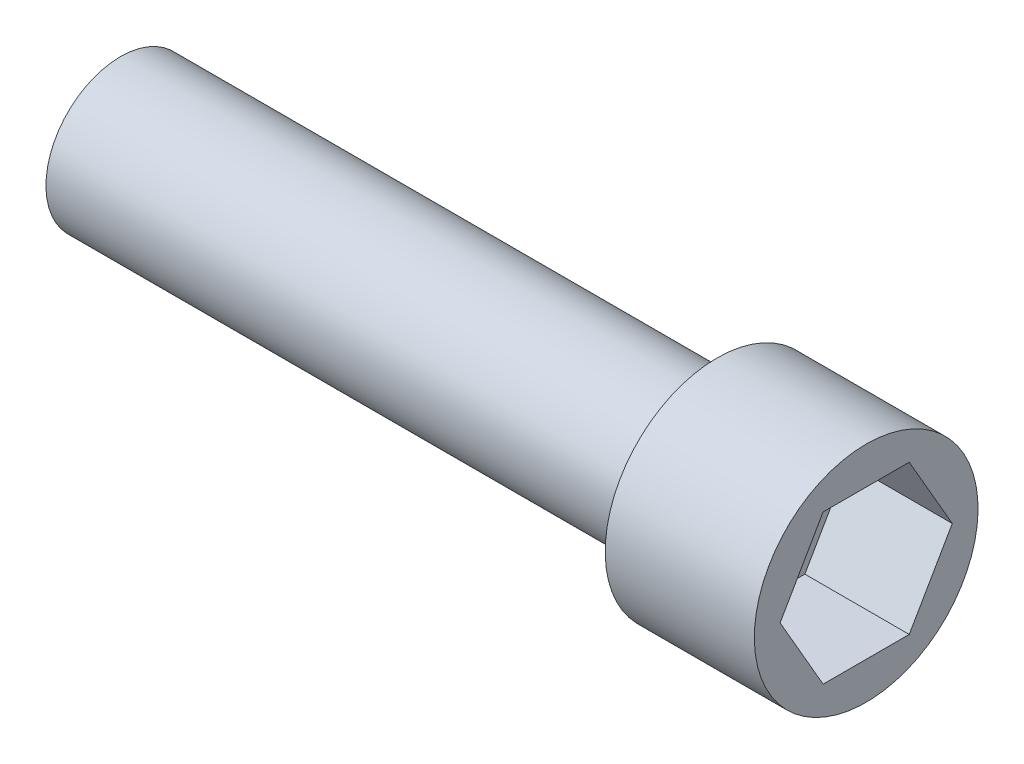
from build123d import *

# Parameters (mm, degrees)
CUT_EXTRUDE2_DEPTH = 7


with BuildPart() as part:
    # Sketch1 → Revolve1 (revolve)
    with BuildSketch(Plane.XY):
        Polygon((0, 0), (0, 5), (40, 5), (40, 7.5), (50, 7.5), (50, 0), align=None)
    revolve(axis=Axis((50, 0, 0), (-1, 0, 0)))

    # Sketch5 → Cut-Extrude2 (cut)
    with BuildSketch(Plane(origin=(50, 0, 0), x_dir=(0, 0, -1), z_dir=(1, 0, 0))):
        Polygon((5.773502692, 0), (2.886751346, 5), (-2.886751346, 5), (-5.773502692, 0), (-2.886751346, -5), (2.886751346, -5), align=None)
    extrude(amount=-CUT_EXTRUDE2_DEPTH, mode=Mode.SUBTRACT)


solid = part.part
